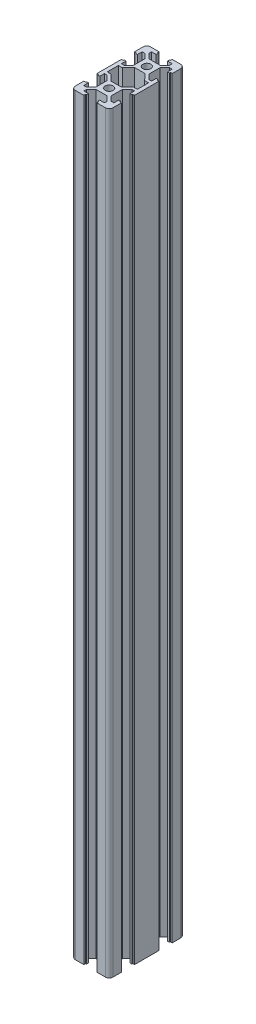
from build123d import *

# Parameters (mm, degrees)
SKETCH_2_R      = 2.1
EXTRUDE_1_DEPTH = 400
FILLET_1_R      = 2
FILLET_2_R      = 0.2


with BuildPart() as part:
    # Эскиз2 → Бобышка-Вытянуть1 (new body)
    with BuildSketch(Plane(origin=(0, 0, 0), x_dir=(1, 0, 0), z_dir=(0, 1, 0))):
        Polygon((-10, -20), (-3.5, -20), (-3.5, -19), (-3, -19.005012563), (-3, -18.005012563), (-5.5, -18.005012563), (-5.5, -16.560660172), (-3, -14.060660172), (3, -14.060660172), (5.5, -16.560660172), (5.5, -18.005012563), (3, -18.005012563), (3, -19.005012563), (3.5, -19), (3.5, -20), (10, -20), (10, -13.5), (9, -13.5), (9.005012563, -13), (8.005012563, -13), (8.005012563, -15.5), (6.560660172, -15.5), (4.060660172, -13), (4.060660172, -7), (6.560660172, -4.5), (8.005012563, -4.5), (8.005012563, -7), (9.005012563, -7), (9, -6.5), (10, -6.5), (10, 6.5), (9, 6.5), (9.005012563, 7), (8.005012563, 7), (8.005012563, 4.5), (6.560660172, 4.5), (4.060660172, 7), (4.060660172, 13), (6.560660172, 15.5), (8.005012563, 15.5), (8.005012563, 13), (9.005012563, 13), (9, 13.5), (10, 13.5), (10, 20), (3.5, 20), (3.5, 19), (3, 19.005012563), (3, 18.005012563), (5.5, 18.005012563), (5.5, 16.560660172), (3, 14.060660172), (-3, 14.060660172), (-5.5, 16.560660172), (-5.5, 18.005012563), (-3, 18.005012563), (-3, 19.005012563), (-3.5, 19), (-3.5, 20), (-10, 20), (-10, 13.5), (-9, 13.5), (-9.005012563, 13), (-8.005012563, 13), (-8.005012563, 15.5), (-6.560660172, 15.5), (-4.060660172, 13), (-4.060660172, 7), (-6.560660172, 4.5), (-8.005012563, 4.5), (-8.005012563, 7), (-9.005012563, 7), (-9, 6.5), (-10, 6.5), (-10, -6.5), (-9, -6.5), (-9.005012563, -7), (-8.005012563, -7), (-8.005012563, -4.5), (-6.560660172, -4.5), (-4.060660172, -7), (-4.060660172, -13), (-6.560660172, -15.5), (-8.005012563, -15.5), (-8.005012563, -13), (-9.005012563, -13), (-9, -13.5), (-10, -13.5), align=None)
        with Locations(Location((0, 10, 0), (0, 0, 270))):
            Circle(SKETCH_2_R, mode=Mode.SUBTRACT)
        with Locations(Location((0, -10, 0), (0, 0, 90))):
            Circle(SKETCH_2_R, mode=Mode.SUBTRACT)
        Polygon((-2.764646715, 6.260660172), (2.764646715, 6.260660172), (5.920319141, 2.935275287), (8.005012563, 2.935275287), (8.005012563, -3.019020687), (5.920319141, -3.019020687), (2.678679656, -6.260660172), (-2.678679656, -6.260660172), (-5.920319141, -3.019020687), (-8.005012563, -3.019020687), (-8.005012563, 2.935275287), (-5.920319141, 2.935275287), align=None, mode=Mode.SUBTRACT)
    extrude(amount=EXTRUDE_1_DEPTH)

    # Скругление1
    fillet_1_edges = [part.edges().sort_by_distance(p)[0] for p in [
        (-10, 200, -20),
        (10, 200, -20),
        (10, 200, 20),
        (-10, 200, 20),
    ]]
    fillet(fillet_1_edges, radius=FILLET_1_R)

    # Скругление2
    fillet_2_edges = [part.edges().sort_by_distance(p)[0] for p in [
        (-9, 200, 13.5),
        (-9, 200, 6.5),
        (-9, 200, -6.5),
        (-9, 200, -13.5),
        (-3.5, 200, -19),
        (3.5, 200, -19),
        (9, 200, -13.5),
        (9, 200, -6.5),
        (9, 200, 6.5),
        (9, 200, 13.5),
        (3.5, 200, 19),
        (-3.5, 200, 19),
    ]]
    fillet(fillet_2_edges, radius=FILLET_2_R)


solid = part.part
